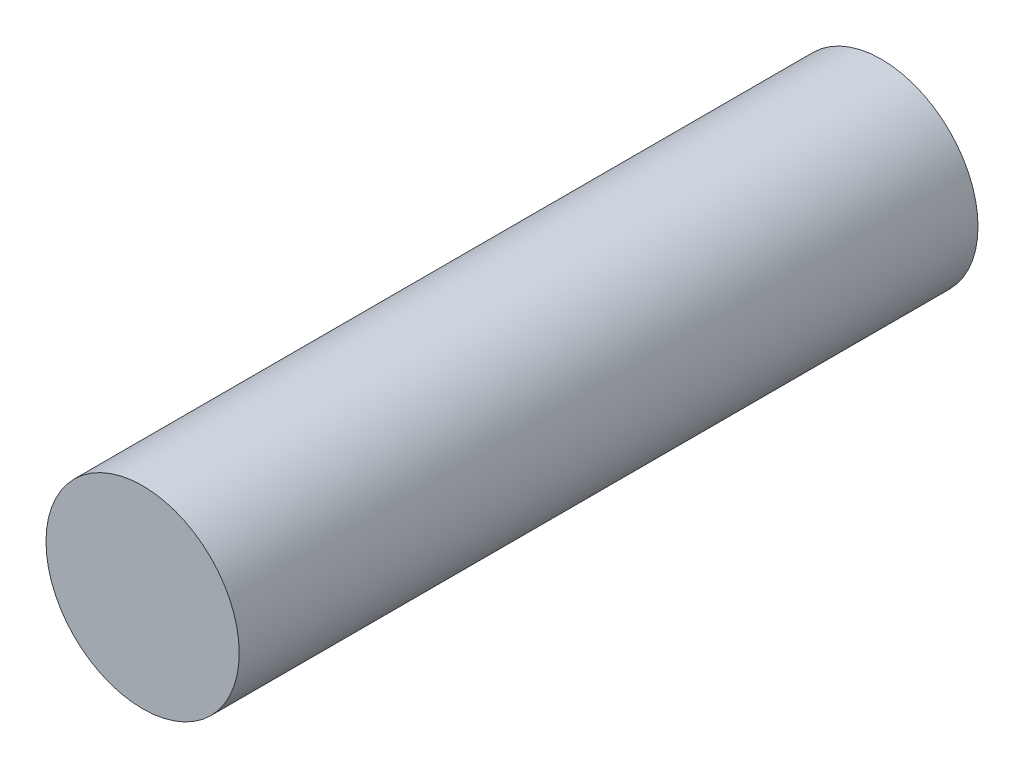
from build123d import *

# Parameters (mm, degrees)
SKETCH1_R           = 8.5
BOSS_EXTRUDE1_DEPTH = 65


with BuildPart() as part:
    # Sketch1 → Boss-Extrude1 (new body)
    with BuildSketch(Plane.XY):
        Circle(SKETCH1_R)
    extrude(amount=-BOSS_EXTRUDE1_DEPTH)


solid = part.part
